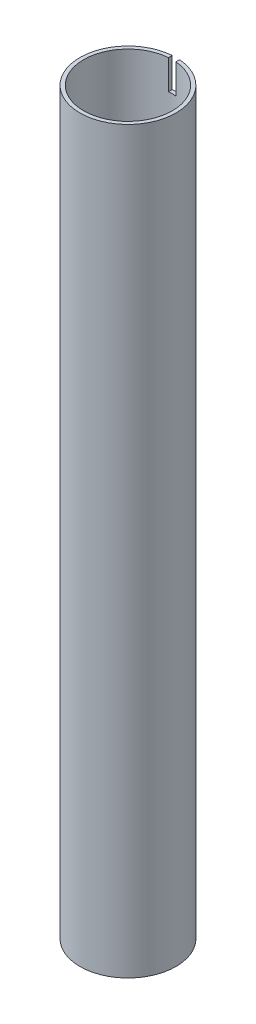
from build123d import *

# Parameters (mm, degrees)
CROQUIS1_R                 = 32.5
CROQUIS1_R_2               = 30
SALIENTE_EXTRUIR1_DEPTH    = 250
CORTAR_EXTRUIR1_REACH      = 256.19
CORTAR_EXTRUIR1_END_RADIUS = 32.5
CROQUIS2_W                 = 5
CROQUIS2_H                 = 20


with BuildPart() as part:
    # Croquis1 → Saliente-Extruir1 (new, symmetric)
    with BuildSketch(Plane(origin=(0, 0, 0), x_dir=(1, 0, 0), z_dir=(0, 1, 0))):
        with Locations(Location((0, 0, 0), (0, 0, 270))):
            Circle(CROQUIS1_R)
        with Locations(Location((0, 0, 0), (0, 0, 270))):
            Circle(CROQUIS1_R_2, mode=Mode.SUBTRACT)
    extrude(amount=SALIENTE_EXTRUIR1_DEPTH, both=True)

    # Cortar-Extruir1: up to this cylinder (the profile starts inside it)
    cortar_extruir1_end = Plane(origin=(0, 0, 0), z_dir=(0, -1, 0)) * Cylinder(CORTAR_EXTRUIR1_END_RADIUS, 1058.38, mode=Mode.PRIVATE)
    # Croquis2 → Cortar-Extruir1 (cut, up to the surface)
    with BuildSketch(Plane.XY, mode=Mode.PRIVATE) as cortar_extruir1_sk1:
        with Locations((0, -240)):
            Rectangle(CROQUIS2_W, CROQUIS2_H)
    cortar_extruir1_tool1 = extrude(cortar_extruir1_sk1.sketch, amount=-CORTAR_EXTRUIR1_REACH, mode=Mode.PRIVATE) & cortar_extruir1_end
    add(cortar_extruir1_tool1.solids().sort_by_distance((0, -240, 0))[0], mode=Mode.SUBTRACT)
    # Croquis2 → Cortar-Extruir1 (cut, up to the surface)
    with BuildSketch(Plane.XY, mode=Mode.PRIVATE) as cortar_extruir1_sk2:
        with Locations((0, 240)):
            Rectangle(CROQUIS2_W, CROQUIS2_H)
    cortar_extruir1_tool2 = extrude(cortar_extruir1_sk2.sketch, amount=-CORTAR_EXTRUIR1_REACH, mode=Mode.PRIVATE) & cortar_extruir1_end
    add(cortar_extruir1_tool2.solids().sort_by_distance((0, 240, 0))[0], mode=Mode.SUBTRACT)


solid = part.part
